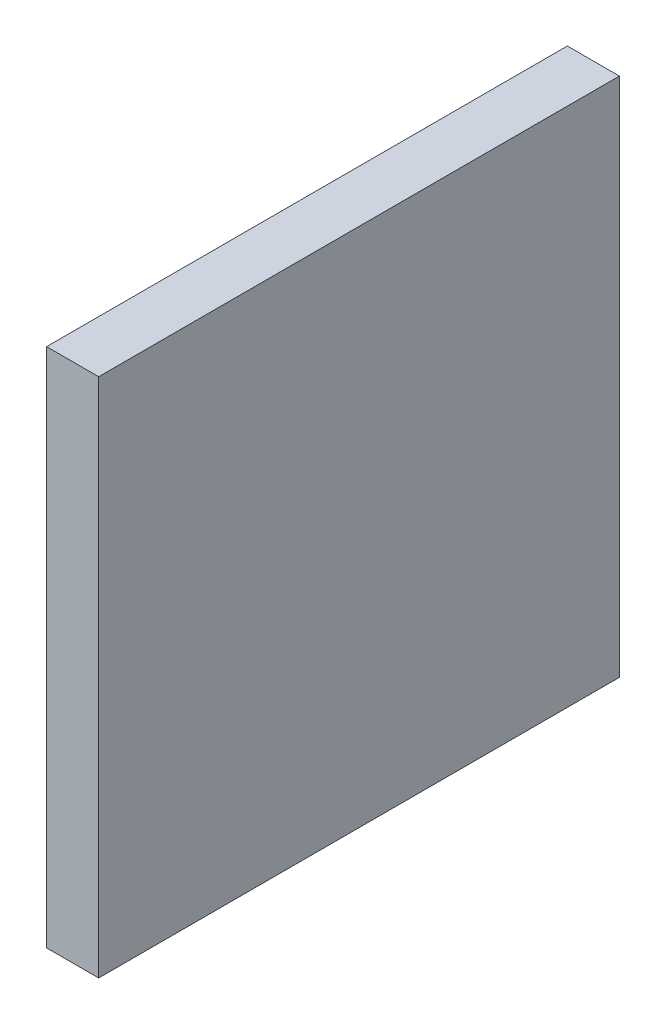
from build123d import *

# Parameters (mm, degrees)
SKETCH1_W           = 100
SKETCH1_H           = 100
BOSS_EXTRUDE1_DEPTH = 10


with BuildPart() as part:
    # Sketch1 → Boss-Extrude1 (new body)
    with BuildSketch(Plane(origin=(0, 0, 0), x_dir=(0, 0, -1), z_dir=(1, 0, 0))):
        Rectangle(SKETCH1_W, SKETCH1_H)
    extrude(amount=BOSS_EXTRUDE1_DEPTH)


solid = part.part
